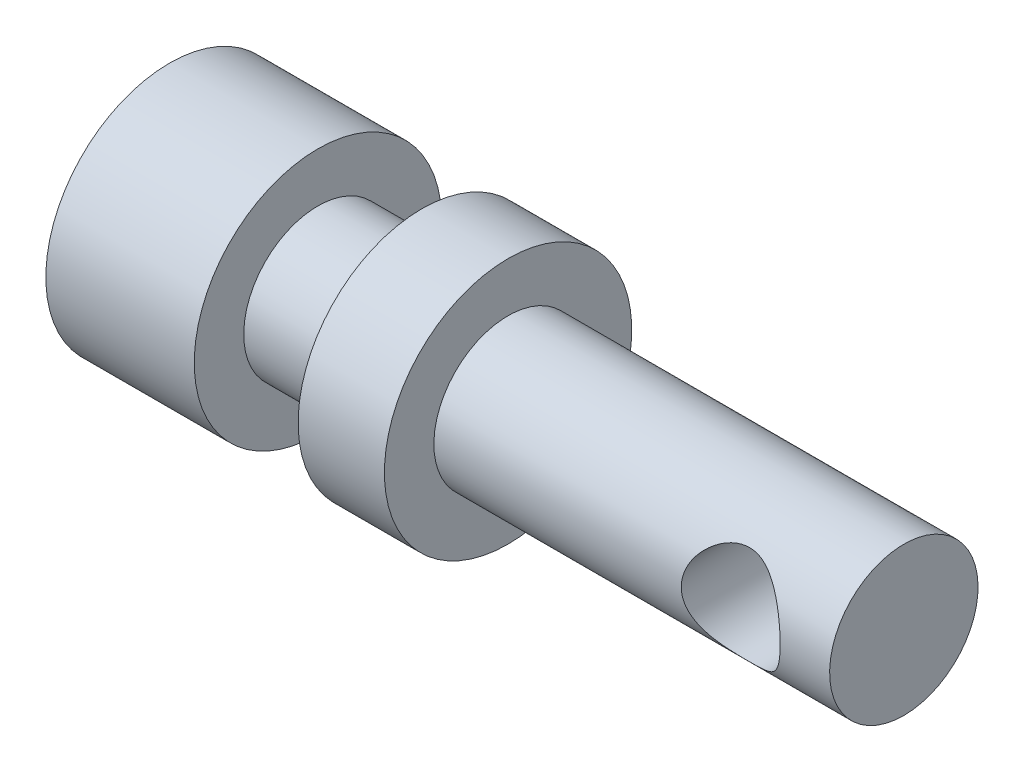
from build123d import *

# Parameters (mm, degrees)
CUT_EXTRUDE1_DEPTH      = 16.259152832
CUT_EXTRUDE1_DEPTH_BACK = 16.259152832
SKETCH2_R               = 1


with BuildPart() as part:
    # Sketch1 → Revolve1 (revolve)
    with BuildSketch(Plane.XY, mode=Mode.PRIVATE) as revolve1_sk:
        Polygon((0, 2.5), (0, 0), (8.84391273, 0), (14.84391273, 0), (14.84391273, 1.5), (6.84391273, 1.5), (6.84391273, 2.5), (5.1, 2.5), (5.1, 1.5), (3, 1.5), (3, 2.5), align=None)
    revolve(revolve1_sk.sketch.rotate(Axis((0, 0, 0), (1, 0, 0)), 180), axis=Axis((0, 0, 0), (1, 0, 0)))

    # Sketch2 → Cut-Extrude1 (cut, two sides: drawn at the far end of the back side and taken through both)
    with BuildSketch(Plane.XY.offset(-CUT_EXTRUDE1_DEPTH_BACK)):
        with Locations((12.84391273, 0)):
            Circle(SKETCH2_R)
    extrude(amount=CUT_EXTRUDE1_DEPTH + CUT_EXTRUDE1_DEPTH_BACK, mode=Mode.SUBTRACT)


solid = part.part
